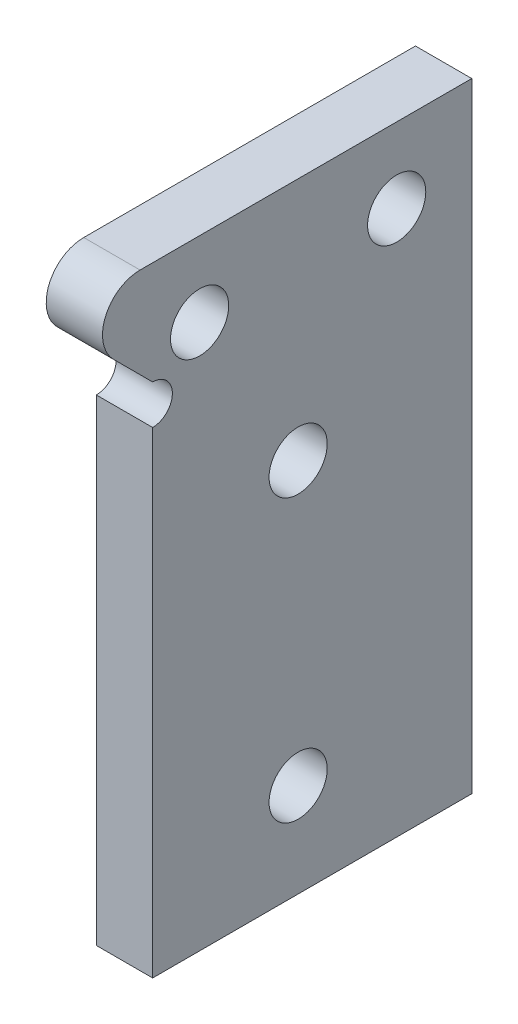
from build123d import *

# Parameters (mm, degrees)
SKETCH_1_R      = 1.55
EXTRUDE_1_DEPTH = 3
FILLET_1_R      = 2


with BuildPart() as part:
    # 草图1 → 凸台-拉伸1 (new body)
    with BuildSketch(Plane(origin=(0, 0, 0), x_dir=(0, 0, -1), z_dir=(1, 0, 0))):
        with BuildLine():
            Line((0, 25.4), (0, 0))
            Line((0, 0), (17, 0))
            Line((17, 0), (17, 33))
            Line((17, 33), (-5.5, 33))
            Line((-5.5, 33), (0, 27.5))
            ThreePointArc((0, 27.5), (0.74246212, 27.19246212), (1.05, 26.45))
            ThreePointArc((1.05, 26.45), (0.74246212, 25.70753788), (0, 25.4))
        make_face()
        with Locations((7.75, 5)):
            Circle(SKETCH_1_R, mode=Mode.SUBTRACT)
        with Locations((2.5, 29)):
            Circle(SKETCH_1_R, mode=Mode.SUBTRACT)
        with Locations((7.75, 20)):
            Circle(SKETCH_1_R, mode=Mode.SUBTRACT)
        with Locations((13, 29)):
            Circle(SKETCH_1_R, mode=Mode.SUBTRACT)
    extrude(amount=EXTRUDE_1_DEPTH)

    # 圆角1
    fillet_1_edges = [part.edges().sort_by_distance(p)[0] for p in [
        (1.5, 33, 5.5),
    ]]
    fillet(fillet_1_edges, radius=FILLET_1_R)


solid = part.part
